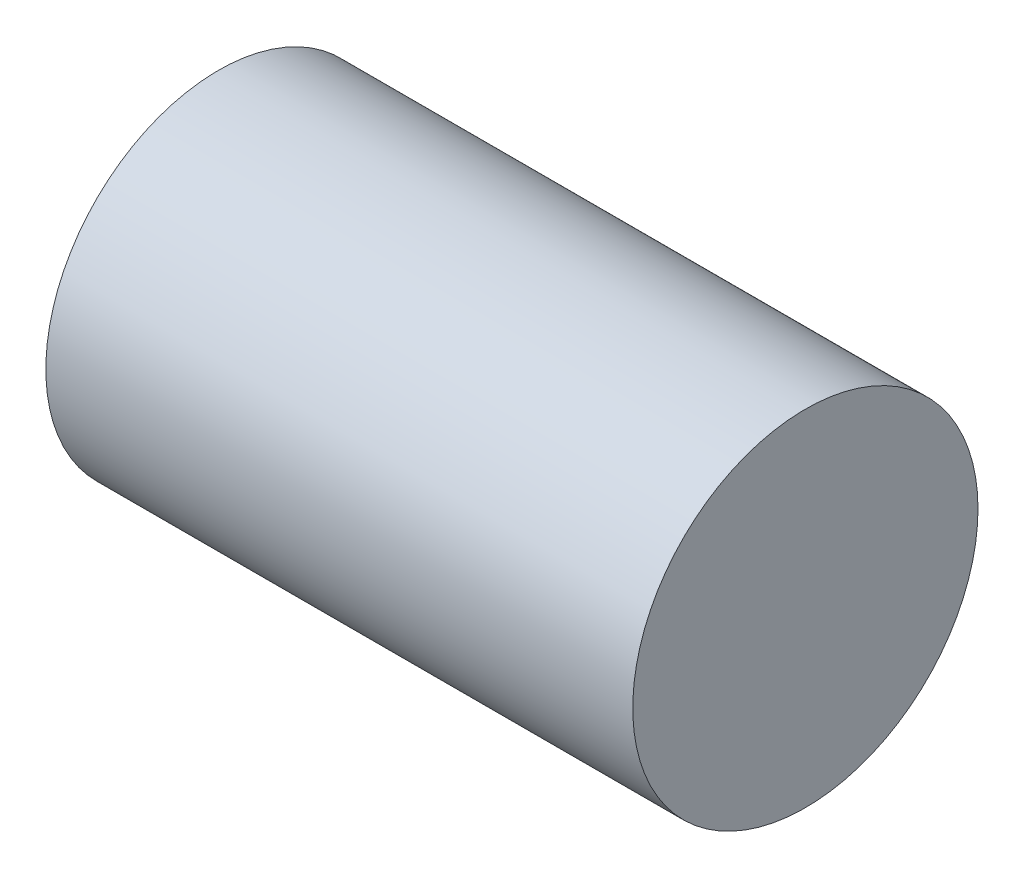
from build123d import *

# Parameters (mm, degrees)
SKETCH_1_R      = 2.5
EXTRUDE_1_DEPTH = 8.5


with BuildPart() as part:
    # 草图1 → 凸台-拉伸1 (new body)
    with BuildSketch(Plane(origin=(0, 0, 0), x_dir=(0, 0, -1), z_dir=(1, 0, 0))):
        Circle(SKETCH_1_R)
    extrude(amount=EXTRUDE_1_DEPTH)


solid = part.part
